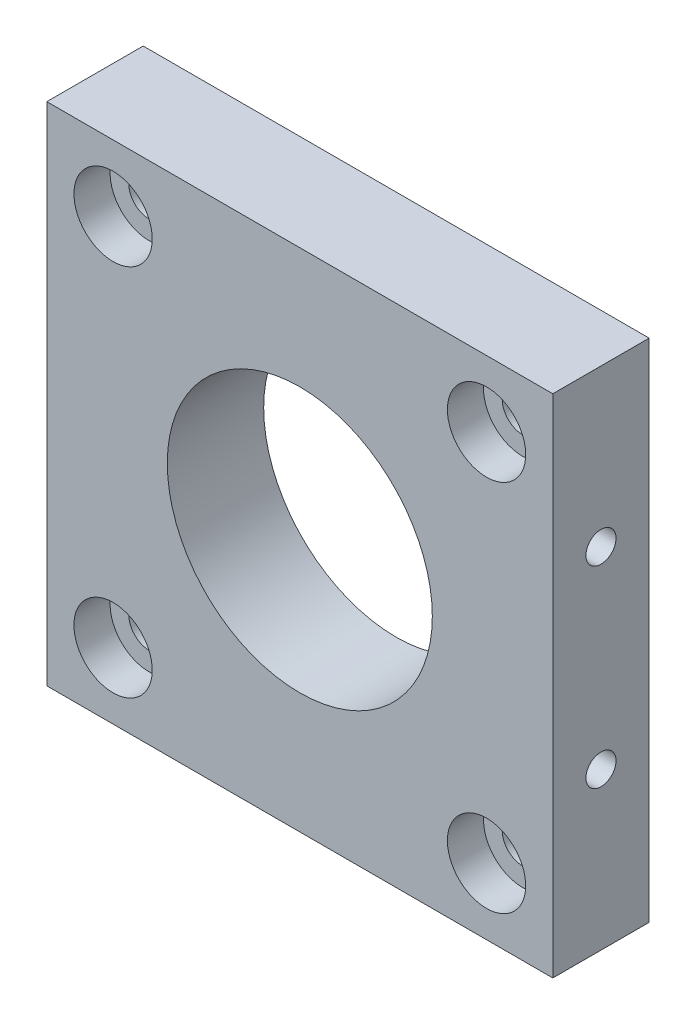
from build123d import *

# Parameters (mm, degrees)
SKETCH_1_W                   = 42
SKETCH_1_H                   = 42
EXTRUDE_1_DEPTH              = 4
SKETCH_2_R                   = 11
CUT_EXTRUDE_1_DEPTH          = 31.757112998
HOLE_WIZARD_M3_1_D           = 3.4
HOLE_WIZARD_M3_1_CBORE_D     = 6.5
HOLE_WIZARD_M3_1_CBORE_DEPTH = 3
PATTERN_CIRCULAR_1_COUNT     = 4
M3X0_5_1_D                   = 2.5
M3X0_5_1_DEPTH               = 10
M3X0_5_1_TIP                 = 0.751075774


with BuildPart() as part:
    # 草圖1 → 填料-伸長1 (new, symmetric)
    with BuildSketch(Plane.XY):
        Rectangle(SKETCH_1_W, SKETCH_1_H)
    extrude(amount=EXTRUDE_1_DEPTH, both=True)

    # 草圖2 → 除料-伸長1 (cut, through all)
    with BuildSketch(Plane.XY.offset(4)):
        Circle(SKETCH_2_R)
    extrude(amount=-CUT_EXTRUDE_1_DEPTH, mode=Mode.SUBTRACT)

    # M3 凹頭蓋螺釘的柱孔1 (through all)
    with Locations(Plane.XY.offset(4)):
        with Locations((-15.5, 15.5)):
            hole_wizard_m3_1 = CounterBoreHole(HOLE_WIZARD_M3_1_D / 2, HOLE_WIZARD_M3_1_CBORE_D / 2, HOLE_WIZARD_M3_1_CBORE_DEPTH)

    # 環狀複製排列1: M3 凹頭蓋螺釘的柱孔1 ×4 about axis
    pattern_circular_1_axis = Axis((0, 0, 0), (0, 0, 1))
    for i in range(1, PATTERN_CIRCULAR_1_COUNT):
        add(hole_wizard_m3_1.rotate(pattern_circular_1_axis, i * 360 / PATTERN_CIRCULAR_1_COUNT), mode=Mode.SUBTRACT)

    # M3x0.5 螺紋孔1
    with Locations(Plane(origin=(21, 0, 0), x_dir=(0, 0, -1), z_dir=(1, 0, 0))):
        with Locations((0, 8), (0, -8)):
            Hole(M3X0_5_1_D / 2, depth=M3X0_5_1_DEPTH)
            with Locations((0, 0, -(M3X0_5_1_DEPTH + M3X0_5_1_TIP / 2))):  # 118° drill point
                Cone(0, M3X0_5_1_D / 2, M3X0_5_1_TIP, mode=Mode.SUBTRACT)


solid = part.part
